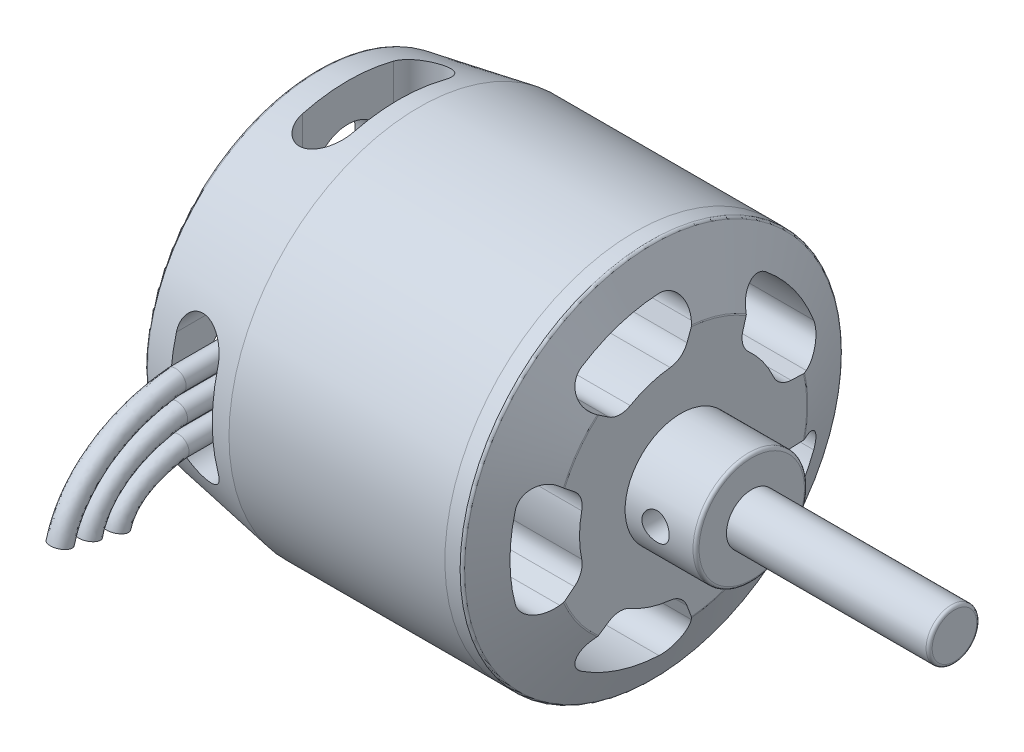
from build123d import *

# Parameters (mm, degrees)
FILLET1_R               = 0.3
CUT_EXTRUDE1_DEPTH      = 10
CUT_EXTRUDE2_DEPTH      = 10
CIRPATTERN1_COUNT       = 4
FILLET2_R               = 0.3
CUT_EXTRUDE3_REACH      = 81.75
CUT_EXTRUDE3_END_RADIUS = 2.7499999999999973
SKETCH5_R               = 1.3500000000000005
SKETCH5_R_2             = 1.3499999999999985
CUT_EXTRUDE4_REACH      = 70.206
SKETCH6_R               = 3.5
SKETCH6_R_2             = 3.4999999999999987
SKETCH6_R_3             = 3.4999999999999982
SKETCH6_R_4             = 1.2250000000000008
CHAMFER1_SIZE           = 0.2
FILLET3_R               = 0.3
SKETCH9_R               = 0.9999999999999998
SKETCH9_R_2             = 1.0000000000000016


with BuildPart() as part:
    # Sketch1 → Revolve1 (revolve)
    with BuildSketch(Plane.XY, mode=Mode.PRIVATE) as revolve1_sk:
        Polygon((0, 0), (0, 4.749999999999994), (5.000000000000001, 4.75), (5.000000000000001, 17), (15.000000000000002, 18.750000000000004), (38, 18.750000000000007), (40.84, 12.500000000000005), (40.84, 5.500000000000006), (47.84, 5.500000000000006), (47.84, 2.5000000000000075), (67.84, 2.5000000000000075), (67.84, -1.54e-15), align=None)
    revolve(revolve1_sk.sketch.rotate(Axis((0, 0, 0), (-1, 0, 0)), 90), axis=Axis((0, 0, 0), (-1, 0, 0)))

    # Fillet1
    fillet1_edges = [part.edges().sort_by_distance(p)[0] for p in [
        (47.84, -1.28e-15, 5.500000000000006),
    ]]
    fillet(fillet1_edges, radius=FILLET1_R)

    # Sketch2 → Cut-Extrude1 (cut)
    with BuildSketch(Plane(origin=(40.84, 0, 0), x_dir=(0, 0, -1), z_dir=(1, 0, 0))):
        with BuildLine():
            ThreePointArc((12.173032753085929, -2.8402946312481956), (10.112712429686793, -7.347315653655991), (6.462954711032995, -10.699542812809177))
            Line((6.46295471103266, -10.699542812809192), (6.55905167298932, -11.041585115081373))
            ThreePointArc((6.55905167298932, -11.041585115081373), (7.876952005385401, -12.406115389377572), (9.741467291986911, -12.056276995787263))
            ThreePointArc((9.741467291986913, -12.056276995787263), (12.539763412811602, -9.110671410533442), (14.476479742474389, -5.539091465730508))
            ThreePointArc((14.476479742474387, -5.53909146573051), (14.233028916516972, -3.657726043771976), (12.528029907862791, -2.8259913889157384))
            Line((12.528029907862791, -2.825991388915738), (12.17303275308585, -2.840294631247919))
        make_face()
        with BuildLine():
            Line((6.112272367427563, -9.451343143115267), (6.46295471103266, -10.699542812809192))
            ThreePointArc((6.462954711032995, -10.699542812809177), (10.112712429686793, -7.347315653655991), (12.173032753085929, -2.8402946312481956))
            Line((12.17303275308585, -2.840294631247919), (10.877557519784753, -2.8924908135212313))
            ThreePointArc((10.877557519784753, -2.892490813521231), (9.836004145610646, -3.23528547921509), (9.131728736999714, -4.075724509072423))
            ThreePointArc((9.131728736999715, -4.075724509072423), (8.090169943749423, -5.877852522924802), (6.69810372073205, -7.425321982669539))
            ThreePointArc((6.698103720732048, -7.425321982669539), (6.116431774818574, -8.354837642257296), (6.112272367427563, -9.451343143115267))
        make_face()
        with BuildLine():
            ThreePointArc((1.0603932765401005, -12.454941432984286), (-3.862712429687026, -11.888206453689365), (-8.178707073916806, -9.452975753648337))
            Line((-8.178707073916712, -9.452975753648584), (-8.474313039988607, -9.650066279710702))
            ThreePointArc((-8.474313039988607, -9.650066279710702), (-9.364804849437244, -11.325127022760174), (-8.455921855731214, -12.990280426910232))
            ThreePointArc((-8.455921855731214, -12.99028042691023), (-4.789763412811853, -14.74137600257482), (-0.7945107736886656, -15.479623788403012))
            ThreePointArc((-0.7945107736886657, -15.479623788403014), (0.9195436278819233, -14.666714405964202), (1.1836966221448735, -12.788143845345708))
            Line((1.183696622144873, -12.788143845345708), (1.0603932765399562, -12.454941432984382))
        make_face()
        with BuildLine():
            Line((-7.099965448217806, -8.73374211530452), (-8.178707073916712, -9.452975753648584))
            ThreePointArc((-8.178707073916806, -9.452975753648337), (-3.862712429687026, -11.888206453689365), (1.0603932765401005, -12.454941432984286))
            Line((1.0603932765399562, -12.454941432984382), (0.6104278943812259, -11.239000778018118))
            ThreePointArc((0.6104278943812258, -11.239000778018118), (-0.03744689934649958, -10.354354031721105), (-1.0543849852222322, -9.944258258057152))
            ThreePointArc((-1.0543849852222318, -9.944258258057154), (-3.090169943749582, -9.510565162951497), (-4.992072977415268, -8.66482587177378))
            ThreePointArc((-4.992072977415267, -8.664825871773779), (-6.055841418903, -8.398859112616943), (-7.099965448217806, -8.73374211530452))
        make_face()
        with BuildLine():
            ThreePointArc((-11.517673666742418, -4.857282502225744), (-12.2519574116604, -2.4778094323131308), (-12.500000000000005, 1.53e-15))
            Line((-12.500000000000005, 1.53e-15), (-15.499999999999996, 1.9e-15))
            ThreePointArc((-15.5, 1.33e-15), (-15.366301983205808, -2.0314436642263183), (-14.967514405041904, -4.0278421685641))
            ThreePointArc((-14.9675144050419, -4.0278421685640975), (-13.664719700347488, -5.406801962401743), (-11.796465163008754, -5.07751616053079))
            Line((-11.796465163008754, -5.077516160530791), (-11.517673666742368, -4.857282502225786))
        make_face()
        with BuildLine():
            Line((-10, 1.22e-15), (-12.500000000000005, 1.53e-15))
            ThreePointArc((-12.500000000000005, 1.53e-15), (-12.2519574116604, -2.4778094323131308), (-11.517673666742418, -4.857282502225744))
            Line((-11.517673666742368, -4.857282502225786), (-10.500292333376072, -4.053593666880569))
            ThreePointArc((-10.500292333376072, -4.053593666880569), (-9.859147602180034, -3.1640572439381494), (-9.783374495094574, -2.0701650873138098))
            ThreePointArc((-9.783374495094574, -2.0701650873138098), (-9.94569617852229, -1.040734127684458), (-10, 1.33e-15))
        make_face()
        with BuildLine():
            ThreePointArc((-12.500000000000005, 1.53e-15), (-12.251957411660399, 2.4778094323131334), (-11.517673666742416, 4.857282502225748))
            Line((-11.517673666742368, 4.857282502225787), (-11.796465163008754, 5.077516160530791))
            ThreePointArc((-11.796465163008754, 5.07751616053079), (-13.664719700347488, 5.406801962401743), (-14.9675144050419, 4.0278421685640975))
            ThreePointArc((-14.9675144050419, 4.027842168564098), (-15.366301983205805, 2.0314436642263196), (-15.5, 1.33e-15))
            Line((-15.499999999999996, 1.9e-15), (-12.500000000000005, 1.53e-15))
        make_face()
        with BuildLine():
            ThreePointArc((-9.783374495094574, 2.0701650873138098), (-9.859147602180034, 3.1640572439381494), (-10.500292333376072, 4.053593666880569))
            Line((-10.500292333376072, 4.053593666880569), (-11.517673666742368, 4.857282502225787))
            ThreePointArc((-11.517673666742416, 4.857282502225748), (-12.251957411660399, 2.4778094323131334), (-12.500000000000005, 1.53e-15))
            Line((-12.500000000000005, 1.53e-15), (-10, 1.22e-15))
            ThreePointArc((-10, 1.33e-15), (-9.94569617852229, 1.0407341276844595), (-9.783374495094575, 2.0701650873138098))
        make_face()
        with BuildLine():
            Line((-8.474313039988472, 9.650066279710826), (-8.178707073916575, 9.452975753648701))
            ThreePointArc((-8.178707073916664, 9.452975753648458), (-3.8627124296868436, 11.888206453689426), (1.0603932765402888, 12.45494143298427))
            Line((1.0603932765401347, 12.454941432984375), (1.1836966221450544, 12.788143845345694))
            ThreePointArc((1.1836966221450544, 12.788143845345694), (0.9195436278821324, 14.666714405964193), (-0.7945107736884461, 15.479623788403032))
            ThreePointArc((-0.7945107736884462, 15.479623788403032), (-4.789763412811645, 14.741376002574896), (-8.455921855731033, 12.990280426910356))
            ThreePointArc((-8.45592185573103, 12.990280426910358), (-9.364804849437084, 11.325127022760313), (-8.474313039988472, 9.650066279710826))
        make_face()
        with BuildLine():
            ThreePointArc((1.0603932765402888, 12.45494143298427), (-3.8627124296868436, 11.888206453689426), (-8.178707073916664, 9.452975753648458))
            Line((-8.178707073916575, 9.452975753648701), (-7.099965448217684, 8.733742115304622))
            ThreePointArc((-7.099965448217684, 8.733742115304622), (-6.055841418902882, 8.398859112617034), (-4.992072977415145, 8.664825871773855))
            ThreePointArc((-4.9920729774151456, 8.664825871773857), (-3.090169943749448, 9.510565162951547), (-1.054384985222092, 9.944258258057175))
            ThreePointArc((-1.0543849852220917, 9.944258258057173), (-0.03744689934635437, 10.35435403172111), (0.6104278943813857, 11.239000778018111))
            Line((0.610427894381386, 11.239000778018111), (1.0603932765401347, 12.454941432984375))
        make_face()
        with BuildLine():
            ThreePointArc((12.173032753085971, 2.840294631248018), (10.112712429686907, 7.347315653655835), (6.46295471103316, 10.69954281280908))
            Line((6.462954711032814, 10.699542812809092), (6.1122723674277, 9.45134314311518))
            ThreePointArc((6.1122723674277, 9.45134314311518), (6.116431774818697, 8.354837642257209), (6.698103720732155, 7.425321982669443))
            ThreePointArc((6.698103720732156, 7.425321982669443), (8.090169943749506, 5.877852522924686), (9.131728736999772, 4.075724509072291))
            ThreePointArc((9.131728736999772, 4.07572450907229), (9.836004145610694, 3.235285479214947), (10.877557519784796, 2.892490813521074))
            Line((10.877557519784796, 2.8924908135210745), (12.173032753085893, 2.840294631247743))
        make_face()
        with BuildLine():
            Line((6.559051672989479, 11.041585115081277), (6.462954711032814, 10.699542812809092))
            ThreePointArc((6.46295471103316, 10.69954281280908), (10.112712429686907, 7.347315653655835), (12.173032753085971, 2.840294631248018))
            Line((12.173032753085893, 2.840294631247743), (12.528029907862834, 2.825991388915557))
            ThreePointArc((12.528029907862834, 2.8259913889155572), (14.233028916517025, 3.6577260437717714), (14.476479742474469, 5.539091465730301))
            ThreePointArc((14.47647974247447, 5.539091465730302), (12.539763412811736, 9.110671410533264), (9.741467291987087, 12.056276995787123))
            ThreePointArc((9.741467291987085, 12.05627699578712), (7.87695200538558, 12.406115389377458), (6.559051672989479, 11.041585115081277))
        make_face()
    extrude(amount=-CUT_EXTRUDE1_DEPTH, mode=Mode.SUBTRACT)

    # Sketch3 → Cut-Extrude2 (cut)
    with BuildSketch(Plane.XY.offset(18.750000000000004)):
        with BuildLine():
            Line((8, -4.500000000000001), (8, 4.500000000000001))
            ThreePointArc((8, 4.500000000000001), (10.5, 7.000000000000003), (13.000000000000002, 4.500000000000001))
            Line((13.000000000000002, 4.500000000000001), (13.000000000000002, -4.500000000000001))
            ThreePointArc((13.000000000000002, -4.500000000000001), (10.5, -7.000000000000001), (8, -4.500000000000001))
        make_face()
    cut_extrude2 = extrude(amount=-CUT_EXTRUDE2_DEPTH, mode=Mode.SUBTRACT)

    # CirPattern1: Cut-Extrude2 ×4 about axis
    cirpattern1_axis = Axis((0, 0, 5.8e-16), (1, 0, 0))
    for i in range(1, CIRPATTERN1_COUNT):
        add(cut_extrude2.rotate(cirpattern1_axis, i * 360 / CIRPATTERN1_COUNT), mode=Mode.SUBTRACT)

    # Fillet2
    fillet2_edges = [part.edges().sort_by_distance(p)[0] for p in [
        (40.84, -11.888206453689472, -3.862712429686696),
        (40.84, -7.347315653656063, 10.112712429686741),
        (40.84, 7.34731565365614, 10.112712429686685),
        (40.84, 11.888206453689419, -3.8627124296868622),
        (40.84, -1.429526247822374, -12.4179891571376),
        (38, -4.38e-15, 18.750000000000007),
        (5.000000000000001, -3.97e-15, 17),
        (0, -1.11e-15, 4.749999999999994),
    ]]
    fillet(fillet2_edges, radius=FILLET2_R)

    # Cut-Extrude3: up to this cylinder (the profile starts outside it)
    cut_extrude3_end = Plane(origin=(23.232071500000004, 0, 0), z_dir=(1, 0, 0)) * Cylinder(CUT_EXTRUDE3_END_RADIUS, 211.215857, mode=Mode.PRIVATE)
    # Sketch5 → Cut-Extrude3 (cut, up to the surface)
    with BuildSketch(Plane.XY.offset(18.750000000000004), mode=Mode.PRIVATE) as cut_extrude3_sk1:
        with Locations((2.6241429502371627, -3.47e-15)):
            Circle(SKETCH5_R)
    cut_extrude3_tool1 = extrude(cut_extrude3_sk1.sketch, amount=-CUT_EXTRUDE3_REACH, mode=Mode.PRIVATE) - cut_extrude3_end
    add(cut_extrude3_tool1.solids().sort_by_distance((2.624143, 0, 18.75))[0], mode=Mode.SUBTRACT)
    # Sketch5 → Cut-Extrude3 (cut, up to the surface)
    with BuildSketch(Plane.XY.offset(18.750000000000004), mode=Mode.PRIVATE) as cut_extrude3_sk2:
        with Locations((43.84, 0)):
            Circle(SKETCH5_R_2)
    cut_extrude3_tool2 = extrude(cut_extrude3_sk2.sketch, amount=-CUT_EXTRUDE3_REACH, mode=Mode.PRIVATE) - cut_extrude3_end
    add(cut_extrude3_tool2.solids().sort_by_distance((43.84, 0, 18.75))[0], mode=Mode.SUBTRACT)

    # Cut-Extrude4: up to this face of the body (flat: up to its plane)
    cut_extrude4_end = Plane(part.part.faces().sort_by_distance((13, 0, -13.483906626))[0])
    # Sketch6 → Cut-Extrude4 (cut, up to the picked face)
    with BuildSketch(Plane.ZY.offset(-5.000000000000001), mode=Mode.PRIVATE) as cut_extrude4_sk1:
        with Locations((-10.3, 0)):
            Circle(SKETCH6_R)
    cut_extrude4_tool1 = split(extrude(cut_extrude4_sk1.sketch, amount=-CUT_EXTRUDE4_REACH, mode=Mode.PRIVATE), bisect_by=cut_extrude4_end, keep=Keep.BOTH, mode=Mode.PRIVATE)
    # Sketch6 → Cut-Extrude4 (cut, up to the picked face)
    with BuildSketch(Plane.ZY.offset(-5.000000000000001), mode=Mode.PRIVATE) as cut_extrude4_sk2:
        with Locations((-6.3e-16, 10.3)):
            Circle(SKETCH6_R_2)
    cut_extrude4_tool2 = split(extrude(cut_extrude4_sk2.sketch, amount=-CUT_EXTRUDE4_REACH, mode=Mode.PRIVATE), bisect_by=cut_extrude4_end, keep=Keep.BOTH, mode=Mode.PRIVATE)
    # Sketch6 → Cut-Extrude4 (cut, up to the picked face)
    with BuildSketch(Plane.ZY.offset(-5.000000000000001), mode=Mode.PRIVATE) as cut_extrude4_sk3:
        with Locations((10.3, 1.26e-15)):
            Circle(SKETCH6_R)
    cut_extrude4_tool3 = split(extrude(cut_extrude4_sk3.sketch, amount=-CUT_EXTRUDE4_REACH, mode=Mode.PRIVATE), bisect_by=cut_extrude4_end, keep=Keep.BOTH, mode=Mode.PRIVATE)
    # Sketch6 → Cut-Extrude4 (cut, up to the picked face)
    with BuildSketch(Plane.ZY.offset(-5.000000000000001), mode=Mode.PRIVATE) as cut_extrude4_sk4:
        with Locations((1.89e-15, -10.3)):
            Circle(SKETCH6_R_3)
    cut_extrude4_tool4 = split(extrude(cut_extrude4_sk4.sketch, amount=-CUT_EXTRUDE4_REACH, mode=Mode.PRIVATE), bisect_by=cut_extrude4_end, keep=Keep.BOTH, mode=Mode.PRIVATE)
    # Sketch6 → Cut-Extrude4 (cut, up to the picked face)
    with BuildSketch(Plane.ZY.offset(-5.000000000000001), mode=Mode.PRIVATE) as cut_extrude4_sk5:
        with Locations((-8.849999999999731, 8.849999999999739)):
            Circle(SKETCH6_R_4)
    cut_extrude4_tool5 = split(extrude(cut_extrude4_sk5.sketch, amount=-CUT_EXTRUDE4_REACH, mode=Mode.PRIVATE), bisect_by=cut_extrude4_end, keep=Keep.BOTH, mode=Mode.PRIVATE)
    # Sketch6 → Cut-Extrude4 (cut, up to the picked face)
    with BuildSketch(Plane.ZY.offset(-5.000000000000001), mode=Mode.PRIVATE) as cut_extrude4_sk6:
        with Locations((8.85000000000027, 8.849999999999202)):
            Circle(SKETCH6_R_4)
    cut_extrude4_tool6 = split(extrude(cut_extrude4_sk6.sketch, amount=-CUT_EXTRUDE4_REACH, mode=Mode.PRIVATE), bisect_by=cut_extrude4_end, keep=Keep.BOTH, mode=Mode.PRIVATE)
    # Sketch6 → Cut-Extrude4 (cut, up to the picked face)
    with BuildSketch(Plane.ZY.offset(-5.000000000000001), mode=Mode.PRIVATE) as cut_extrude4_sk7:
        with Locations((8.84999999999867, -8.8500000000008)):
            Circle(SKETCH6_R_4)
    cut_extrude4_tool7 = split(extrude(cut_extrude4_sk7.sketch, amount=-CUT_EXTRUDE4_REACH, mode=Mode.PRIVATE), bisect_by=cut_extrude4_end, keep=Keep.BOTH, mode=Mode.PRIVATE)
    # Sketch6 → Cut-Extrude4 (cut, up to the picked face)
    with BuildSketch(Plane.ZY.offset(-5.000000000000001), mode=Mode.PRIVATE) as cut_extrude4_sk8:
        with Locations((-8.850000000001325, -8.849999999998143)):
            Circle(SKETCH6_R_4)
    cut_extrude4_tool8 = split(extrude(cut_extrude4_sk8.sketch, amount=-CUT_EXTRUDE4_REACH, mode=Mode.PRIVATE), bisect_by=cut_extrude4_end, keep=Keep.BOTH, mode=Mode.PRIVATE)
    add(cut_extrude4_tool1.solids().sort_by(Axis((5, 0, -10.3), (1, 0, 0)))[0], mode=Mode.SUBTRACT)
    add(cut_extrude4_tool2.solids().sort_by(Axis((5, 10.3, 0), (1, 0, 0)))[0], mode=Mode.SUBTRACT)
    add(cut_extrude4_tool3.solids().sort_by(Axis((5, 0, 10.3), (1, 0, 0)))[0], mode=Mode.SUBTRACT)
    add(cut_extrude4_tool4.solids().sort_by(Axis((5, -10.3, 0), (1, 0, 0)))[0], mode=Mode.SUBTRACT)
    add(cut_extrude4_tool5.solids().sort_by(Axis((5, 8.85, -8.85), (1, 0, 0)))[0], mode=Mode.SUBTRACT)
    add(cut_extrude4_tool6.solids().sort_by(Axis((5, 8.85, 8.85), (1, 0, 0)))[0], mode=Mode.SUBTRACT)
    add(cut_extrude4_tool7.solids().sort_by(Axis((5, -8.85, 8.85), (1, 0, 0)))[0], mode=Mode.SUBTRACT)
    add(cut_extrude4_tool8.solids().sort_by(Axis((5, -8.85, -8.85), (1, 0, 0)))[0], mode=Mode.SUBTRACT)

    # Chamfer1
    chamfer1_edges = [part.edges().sort_by_distance(p)[0] for p in [
        (5.000000000000001, 8.849999999999739, -10.074999999999733),
        (5.000000000000001, -10.3, -3.4999999999999964),
        (5.000000000000001, 1.69e-15, 6.800000000000001),
        (5.000000000000001, 10.3, -3.499999999999999),
        (5.000000000000001, 8.849999999999202, 7.625000000000269),
        (5.000000000000001, -8.8500000000008, 7.624999999998669),
        (5.000000000000001, -8.849999999998143, -10.075000000001326),
        (5.000000000000001, 4.3e-16, -13.8),
    ]]
    chamfer(chamfer1_edges, length=CHAMFER1_SIZE)

    # Fillet3
    fillet3_edges = [part.edges().sort_by_distance(p)[0] for p in [
        (67.84, -5.8e-16, 2.5000000000000075),
    ]]
    fillet(fillet3_edges, radius=FILLET3_R)


with BuildPart() as body_2:
    # Sweep1: sweep along a path in Sketch10
    with BuildLine() as sweep1_path:  # in the path sketch's own coordinates; laid on its plane below (add() does not lay a ready-made edge on the line's plane)
        Line((-13.799999999999999, 0), (-19.277106940421618, 0))
        add(Edge.make_bspline(
            [(-19.277106940421618, -6.7e-16), (-22.90105078150047, -0.34531125676620716), (-27.060329507061713, -2.1577341761548094), (-28.077540648553168, -6.078069398142816)],
            knots=[0, 0, 0, 0, 1, 1, 1, 1], degree=3))
    # Sketch9 → Sweep1 (sweep)
    with BuildSketch(Plane.XY.offset(13.799999999999999)):
        with Locations((10.445500111441735, 2.875994960517203)):
            Circle(SKETCH9_R)
        with Locations((10.445500111441735, 0)):
            Circle(SKETCH9_R_2)
        with Locations((10.445500111441735, -2.875994960517203)):
            Circle(SKETCH9_R_2)
    sweep(path=Plane(origin=(10.445500111441735, 0, 0), x_dir=(0, 0, -1), z_dir=(1, 0, 0)) * sweep1_path.line, transition=Transition.RIGHT)


solid = Compound([part.part, body_2.part])
